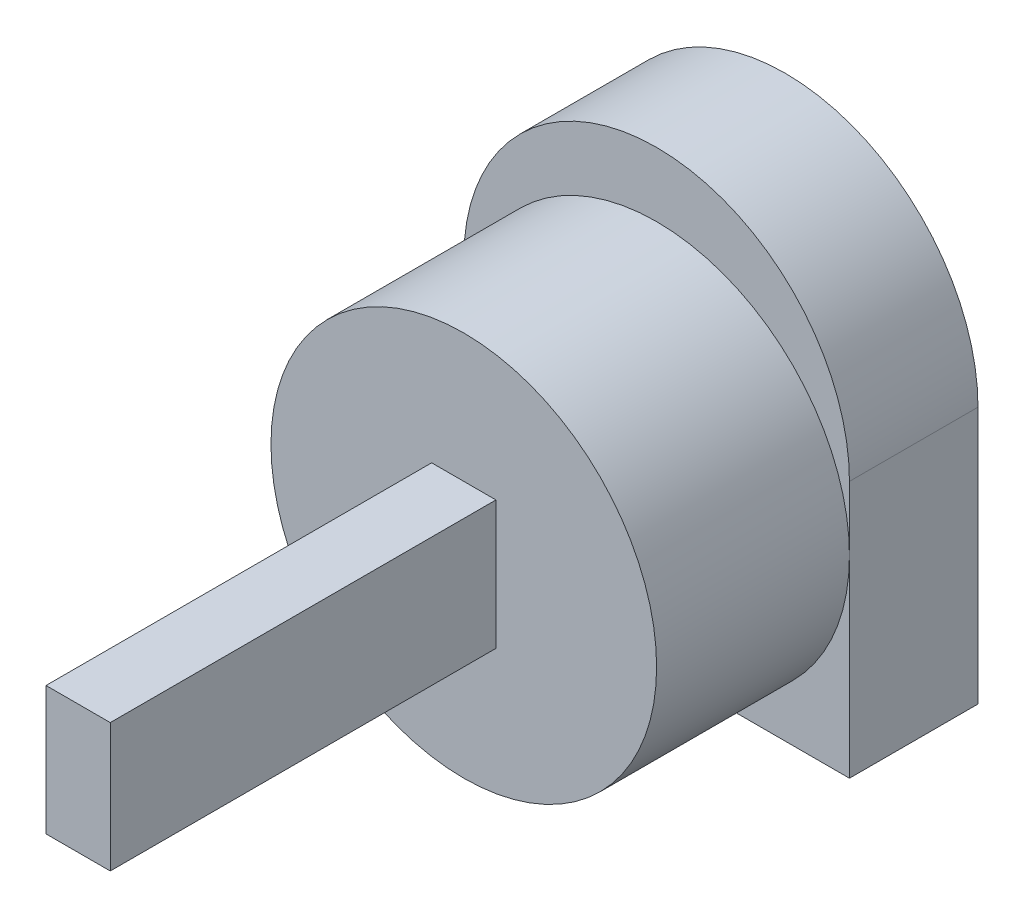
from build123d import *

# Parameters (mm, degrees)
EXTRUDE_1_DEPTH = 10
SKETCH_2_R      = 15
EXTRUDE_2_DEPTH = 15
SKETCH_3_W      = 5
SKETCH_3_H      = 10
EXTRUDE_3_DEPTH = 30


with BuildPart() as part:
    # ｽｹｯﾁ1 → ﾎﾞｽ - 押し出し1 (new body)
    with BuildSketch(Plane.XY):
        with BuildLine():
            Line((0, 0), (30, 0))
            Line((30, 0), (30, 20))
            ThreePointArc((30, 20), (15, 35), (0, 20))
            Line((0, 20), (0, 0))
        make_face()
    extrude(amount=EXTRUDE_1_DEPTH)

    # ｽｹｯﾁ2 → ﾎﾞｽ - 押し出し2 (add)
    with BuildSketch(Plane.XY.offset(10)):
        with Locations((15, 15)):
            Circle(SKETCH_2_R)
    extrude(amount=EXTRUDE_2_DEPTH)

    # ｽｹｯﾁ3 → ﾎﾞｽ - 押し出し3 (add)
    with BuildSketch(Plane.XY.offset(25)):
        with Locations((15, 15)):
            Rectangle(SKETCH_3_W, SKETCH_3_H)
    extrude(amount=EXTRUDE_3_DEPTH)


solid = part.part
